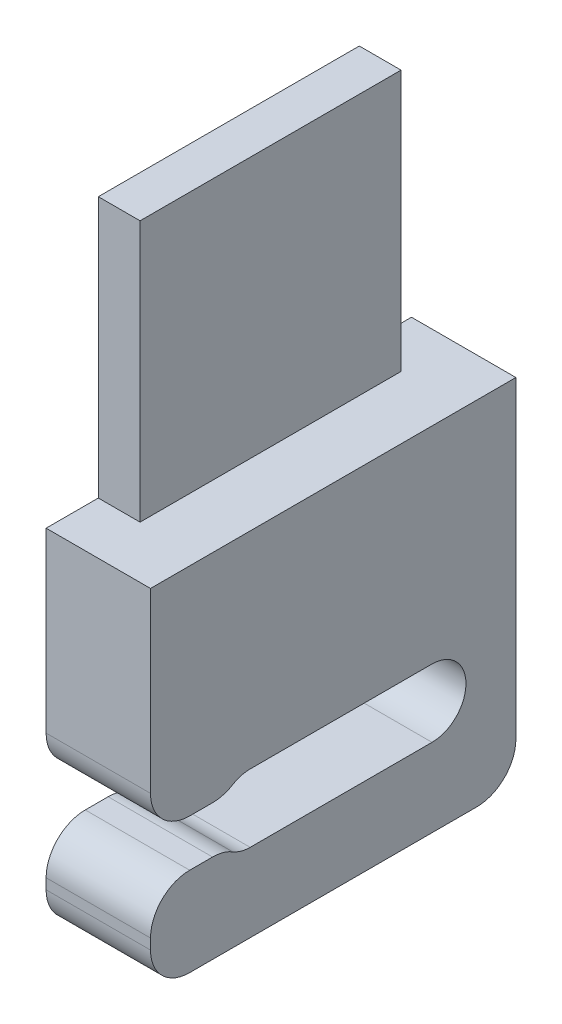
from build123d import *

# Parameters (mm, degrees)
SKETCH1_W           = 10
SKETCH1_H           = 10
BOSS_EXTRUDE1_DEPTH = 1.6
BOSS_EXTRUDE2_DEPTH = 10
SKETCH3_W           = 4
SKETCH3_H           = 2
BOSS_EXTRUDE3_DEPTH = 2
SKETCH4_W           = 4
SKETCH4_H           = 2
BOSS_EXTRUDE4_DEPTH = 2
BOSS_EXTRUDE5_DEPTH = 4
FILLET1_R           = 1.5


with BuildPart() as part:
    # Sketch1 → Boss-Extrude1 (new body)
    with BuildSketch(Plane(origin=(0, 0, 0), x_dir=(0, 0, -1), z_dir=(1, 0, 0))):
        with Locations((5, -5)):
            Rectangle(SKETCH1_W, SKETCH1_H)
    extrude(amount=BOSS_EXTRUDE1_DEPTH)

    # Sketch2 → Boss-Extrude2 (add)
    with BuildSketch(Plane.XY):
        Polygon((1.2, -12), (0, -12), (0, -10), (1.6, -10), (4, -10), (4, -12), (2.8, -12), align=None)
    extrude(amount=-BOSS_EXTRUDE2_DEPTH)

    # Sketch3 → Boss-Extrude3 (add)
    with BuildSketch(Plane.XY):
        with Locations((2, -11)):
            Rectangle(SKETCH3_W, SKETCH3_H)
    extrude(amount=BOSS_EXTRUDE3_DEPTH)

    # Sketch4 → Boss-Extrude4 (add)
    with BuildSketch(Plane(origin=(0, 0, -10), x_dir=(-1, 0, 0), z_dir=(0, 0, -1))):
        with Locations((-2, -11)):
            Rectangle(SKETCH4_W, SKETCH4_H)
    extrude(amount=BOSS_EXTRUDE4_DEPTH)

    # Sketch5 → Boss-Extrude5 (add)
    with BuildSketch(Plane(origin=(4, 0, 0), x_dir=(0, 0, -1), z_dir=(1, 0, 0))):
        with BuildLine():
            Line((12, -12), (-2, -12))
            Line((-2, -12), (-2, -16.665516671))
            Line((-2, -16.665516671), (-2, -18.3))
            Line((-2, -18.3), (0.880666042, -18.3))
            ThreePointArc((0.880666042, -18.3), (1.308847242, -18.004173926), (1.818749194, -17.9))
            Line((1.818749194, -17.9), (8.787112078, -17.9))
            ThreePointArc((8.787112078, -17.9), (9.706350893, -18.280761184), (10.087112078, -19.2))
            ThreePointArc((10.087112078, -19.2), (9.706350893, -20.119238816), (8.787112078, -20.5))
            Line((8.787112078, -20.5), (1.818749194, -20.5))
            ThreePointArc((1.818749194, -20.5), (1.308847242, -20.395826074), (0.880666042, -20.1))
            Line((0.880666042, -20.1), (-2, -20.1))
            Line((-2, -20.1), (-2, -22))
            ThreePointArc((-2, -22), (-1.560660172, -23.060660172), (-0.5, -23.5))
            Line((-0.5, -23.5), (10.5, -23.5))
            ThreePointArc((10.5, -23.5), (11.560660172, -23.060660172), (12, -22))
            Line((12, -22), (12, -12))
        make_face()
    extrude(amount=-BOSS_EXTRUDE5_DEPTH)

    # Fillet1
    fillet1_edges = [part.edges().sort_by_distance(p)[0] for p in [
        (2, -20.1, 2),
        (2, -20.1, -0.880666042),
        (2, -18.3, -0.880666042),
        (2, -18.3, 2),
    ]]
    fillet(fillet1_edges, radius=FILLET1_R)


solid = part.part
